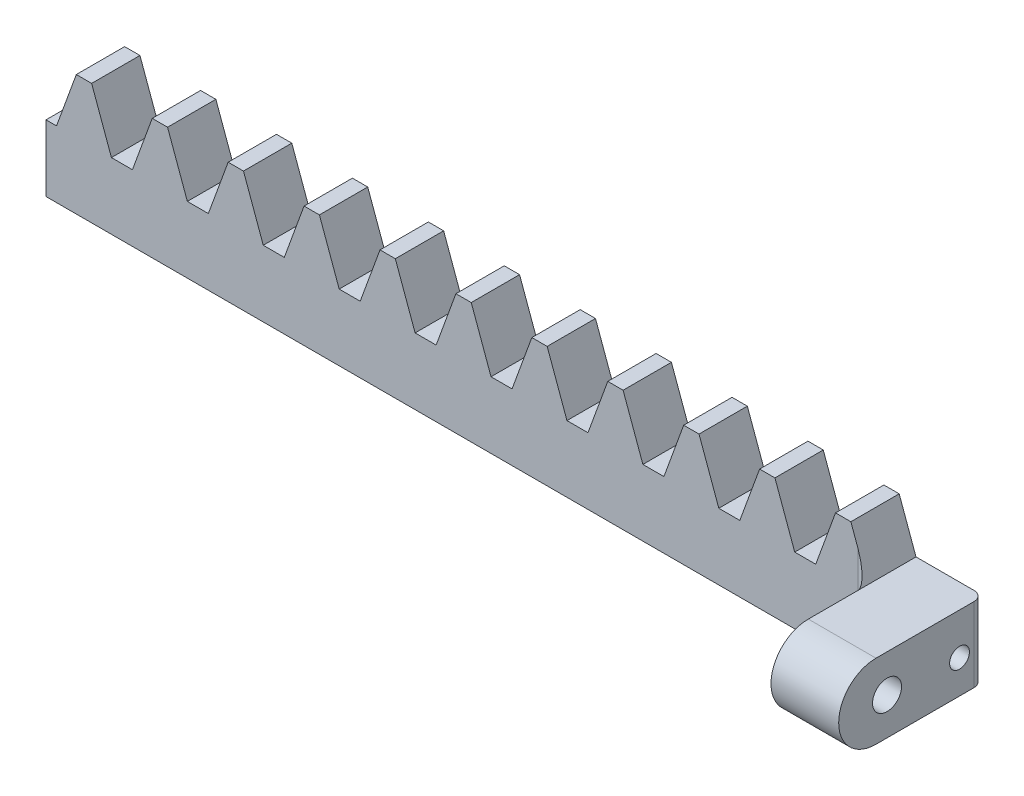
from build123d import *

# Parameters (mm, degrees)
BLANKSKE_W              = 85
BLANKSKE_H              = 12.5
BLANK_DEPTH             = 5
TOOTHCUTSIM_DEPTH       = 87.05957239
TEETHCUTS_COUNT         = 12
TEETHCUTS_PITCH         = 7.853981625
ESQUISSE1_R             = 1.025
ENL_V_MAT_EXTRU_1_DEPTH = 87.05957239
ESQUISSE3_W             = 5
ESQUISSE3_H             = 7.71767729
ESQUISSE3_R             = 1.025
BOSS_EXTRU_1_DEPTH      = 7
ESQUISSE4_W             = 7
ESQUISSE4_H             = 7.71767729
BOSS_EXTRU_2_DEPTH      = 10
ESQUISSE5_R             = 1.5
ENL_V_MAT_EXTRU_2_DEPTH = 87.49421946
CONG_1_RADIUS           = 3.858838645
CONG_1_LENGTH           = 7
CONG_2_R                = 1
CONG_3_R                = 1


with BuildPart() as part:
    # BlankSke → Blank (new body)
    with BuildSketch(Plane.XY):
        with Locations((42.5, 6.25)):
            Rectangle(BLANKSKE_W, BLANKSKE_H)
    extrude(amount=-BLANK_DEPTH)

    # TooCutSkeSim → ToothCutSim (cut, through all)
    with BuildSketch(Plane.XY):
        Polygon((1.087088424, 6.875), (-1.087088424, 6.875), (-3.143665836, 12.5254), (3.143665836, 12.5254), align=None)
    toothcutsim = extrude(amount=-TOOTHCUTSIM_DEPTH, mode=Mode.SUBTRACT)

    # TeethCuts: ToothCutSim ×12
    with Locations(*[(i * TEETHCUTS_PITCH, 0, 0) for i in range(1, TEETHCUTS_COUNT)]):
        add(toothcutsim, mode=Mode.SUBTRACT)

    # Esquisse1 → Enlèv. mat.-Extru.1 (cut, through all)
    with BuildSketch(Plane.ZY):
        with Locations((-2.5, 3.4375)):
            Circle(ESQUISSE1_R)
    extrude(amount=-ENL_V_MAT_EXTRU_1_DEPTH, mode=Mode.SUBTRACT)

    # Esquisse3 → Boss.-Extru.1 (add)
    with BuildSketch(Plane(origin=(85, 0, 0), x_dir=(0, 0, -1), z_dir=(1, 0, 0))):
        with Locations((2.5, 3.858838645)):
            Rectangle(ESQUISSE3_W, ESQUISSE3_H)
        with Locations(Location((2.5, 3.4375, 0), (0, 0, 180))):
            Circle(ESQUISSE3_R, mode=Mode.SUBTRACT)
    extrude(amount=BOSS_EXTRU_1_DEPTH)

    # Esquisse4 → Boss.-Extru.2 (add)
    with BuildSketch(Plane.XY):
        with Locations((88.5, 3.858838645)):
            Rectangle(ESQUISSE4_W, ESQUISSE4_H)
    extrude(amount=BOSS_EXTRU_2_DEPTH)

    # Esquisse5 → Enlèv. mat.-Extru.2 (cut, through all)
    with BuildSketch(Plane.ZY.offset(-85)):
        with Locations((5, 3.858838645)):
            Circle(ESQUISSE5_R)
    extrude(amount=-ENL_V_MAT_EXTRU_2_DEPTH, mode=Mode.SUBTRACT)

    # Congé1: full round fillet: the end face becomes a half cylinder, R = half its width
    cong_1_face = Plane((88.5, 3.858838645, 10), x_dir=(-1, 0, 0), z_dir=(0, 0, 1))  # on the end face: x along it, z out of the body
    cong_1_slab = cong_1_face.offset(-CONG_1_RADIUS / 2) * Box(CONG_1_LENGTH, 2 * CONG_1_RADIUS, CONG_1_RADIUS, mode=Mode.PRIVATE)  # the body's end, R deep
    cong_1_round = Plane((88.5, 3.858838645, 6.141161355), x_dir=(0, 0, 1), z_dir=(-1, 0, 0)) * Cylinder(CONG_1_RADIUS, CONG_1_LENGTH, mode=Mode.PRIVATE)  # its axis R under the face
    add(cong_1_slab - cong_1_round, mode=Mode.SUBTRACT)

    # Congé2
    cong_2_edges = [part.edges().sort_by_distance(p)[0] for p in [
        (85, 3.858838645, 0),
    ]]
    fillet(cong_2_edges, radius=CONG_2_R)

    # Congé3
    cong_3_edges = [part.edges().sort_by_distance(p)[0] for p in [
        (92, 3.858838645, -5),
    ]]
    fillet(cong_3_edges, radius=CONG_3_R)


solid = part.part
